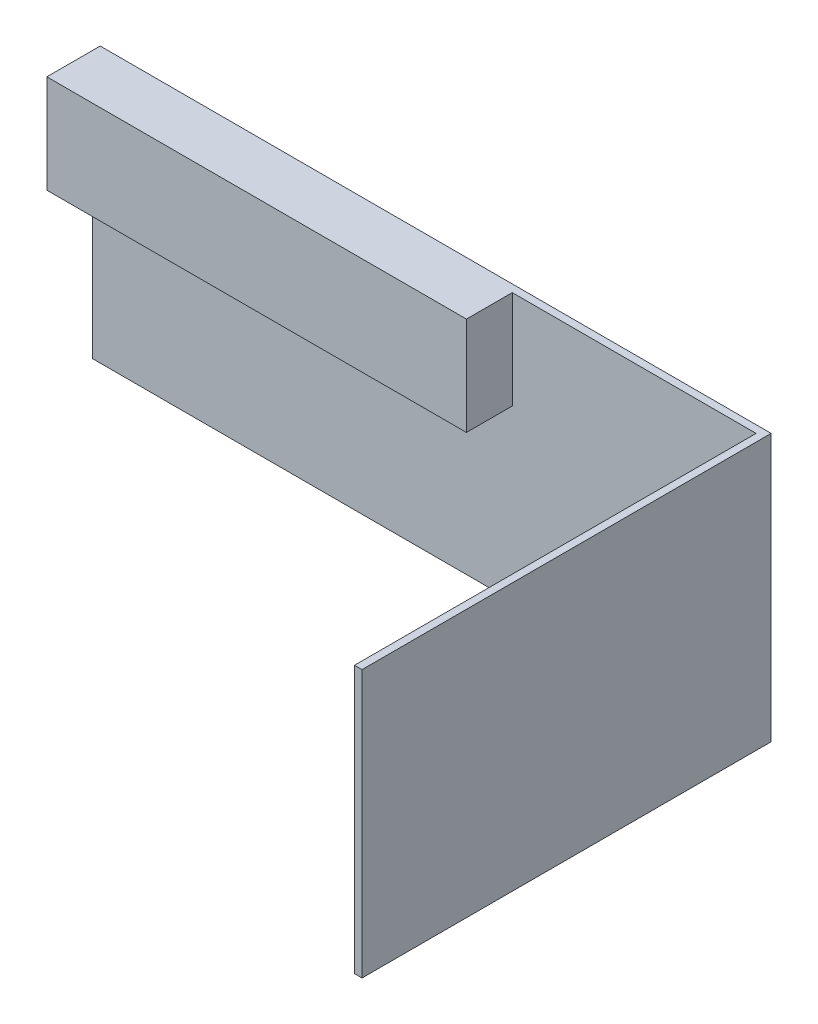
from build123d import *

# Parameters (mm, degrees)
SKETCH_1_W      = 20.5
SKETCH_1_H      = 8.16
EXTRUDE_1_DEPTH = 0.23
SKETCH_2_W      = 12.82
SKETCH_2_H      = 3
EXTRUDE_2_DEPTH = 1.4
SKETCH_3_W      = 0.23
SKETCH_3_H      = 8.16
EXTRUDE_3_DEPTH = 12.27


with BuildPart() as part:
    # 草图1 → 凸台-拉伸1 (new body)
    with BuildSketch(Plane.XY):
        with Locations((-11.527217391, 1.472347826)):
            Rectangle(SKETCH_1_W, SKETCH_1_H)
    extrude(amount=EXTRUDE_1_DEPTH)

    # 草图2 → 凸台-拉伸2 (add)
    with BuildSketch(Plane.XY.offset(0.23)):
        with Locations((-15.367217391, 4.052347826)):
            Rectangle(SKETCH_2_W, SKETCH_2_H)
    extrude(amount=EXTRUDE_2_DEPTH)

    # 草图3 → 凸台-拉伸3 (add)
    with BuildSketch(Plane.XY.offset(0.23)):
        with Locations((-1.392217391, 1.472347826)):
            Rectangle(SKETCH_3_W, SKETCH_3_H)
    extrude(amount=EXTRUDE_3_DEPTH)


solid = part.part
